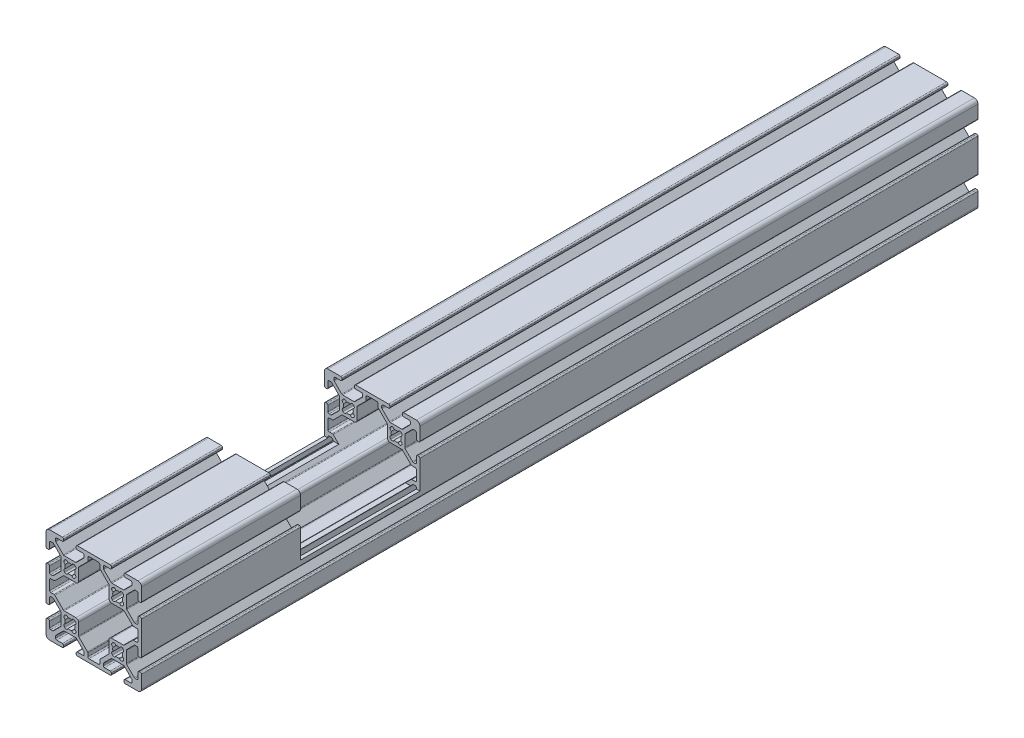
from build123d import *

# Parameters (mm, degrees)
EXTRUDE1_DEPTH     = 350
SKETCH2_W          = 50
SKETCH2_H          = 25
CUT_EXTRUDE2_DEPTH = 62


with BuildPart() as part:
    # Sketch1 → Extrude1 (new body)
    with BuildSketch(Plane.XY):
        with BuildLine():
            Line((-22.383919339, -3.655), (-17.616080661, -3.655))
            ThreePointArc((-17.616080661, -3.655), (-17.421677478, -3.693669197), (-17.256870417, -3.803789755))
            Line((-17.256870417, -3.803789755), (-14.153789755, -6.906870417))
            ThreePointArc((-14.153789755, -6.906870417), (-14.043669197, -7.071677478), (-14.005, -7.266080661))
            Line((-14.005, -7.266080661), (-14.005, -7.992))
            ThreePointArc((-14.005, -7.992), (-14.153789755, -8.351210245), (-14.513, -8.5))
            Line((-14.513, -8.5), (-16.862, -8.5))
            ThreePointArc((-16.862, -8.5), (-17.221210245, -8.648789755), (-17.37, -9.008))
            Line((-17.37, -9.008), (-17.37, -9.492))
            ThreePointArc((-17.37, -9.492), (-17.221210245, -9.851210245), (-16.862, -10))
            Line((-16.862, -10), (-3.138, -10))
            ThreePointArc((-3.138, -10), (-2.778789755, -9.851210245), (-2.63, -9.492))
            Line((-2.63, -9.492), (-2.63, -9.008))
            ThreePointArc((-2.63, -9.008), (-2.778789755, -8.648789755), (-3.138, -8.5))
            Line((-3.138, -8.5), (-5.487, -8.5))
            ThreePointArc((-5.487, -8.5), (-5.846210245, -8.351210245), (-5.995, -7.992))
            Line((-5.995, -7.992), (-5.995, -7.266080661))
            ThreePointArc((-5.995, -7.266080661), (-5.956330803, -7.071677478), (-5.846210245, -6.906870417))
            Line((-5.846210245, -6.906870417), (-2.743129583, -3.803789755))
            ThreePointArc((-2.743129583, -3.803789755), (-2.578322522, -3.693669197), (-2.383919339, -3.655))
            Line((-2.383919339, -3.655), (2.383919339, -3.655))
            ThreePointArc((2.383919339, -3.655), (2.578322522, -3.693669197), (2.743129583, -3.803789755))
            Line((2.743129583, -3.803789755), (5.846210245, -6.906870417))
            ThreePointArc((5.846210245, -6.906870417), (5.956330803, -7.071677478), (5.995, -7.266080661))
            Line((5.995, -7.266080661), (5.995, -7.992))
            ThreePointArc((5.995, -7.992), (5.846210245, -8.351210245), (5.487, -8.5))
            Line((5.487, -8.5), (3.138, -8.5))
            ThreePointArc((3.138, -8.5), (2.778789755, -8.648789755), (2.63, -9.008))
            Line((2.63, -9.008), (2.63, -9.492))
            ThreePointArc((2.63, -9.492), (2.778789755, -9.851210245), (3.138, -10))
            Line((3.138, -10), (8.5, -10))
            ThreePointArc((8.5, -10), (9.560660172, -9.560660172), (10, -8.5))
            Line((10, -8.5), (10, -3.138))
            ThreePointArc((10, -3.138), (9.851210245, -2.778789755), (9.492, -2.63))
            Line((9.492, -2.63), (9.008, -2.63))
            ThreePointArc((9.008, -2.63), (8.648789755, -2.778789755), (8.5, -3.138))
            Line((8.5, -3.138), (8.5, -5.487))
            ThreePointArc((8.5, -5.487), (8.351210245, -5.846210245), (7.992, -5.995))
            Line((7.992, -5.995), (7.266080661, -5.995))
            ThreePointArc((7.266080661, -5.995), (7.071677478, -5.956330803), (6.906870417, -5.846210245))
            Line((6.906870417, -5.846210245), (3.803789755, -2.743129583))
            ThreePointArc((3.803789755, -2.743129583), (3.693669197, -2.578322522), (3.655, -2.383919339))
            Line((3.655, -2.383919339), (3.655, 2.383919339))
            ThreePointArc((3.655, 2.383919339), (3.693669197, 2.578322522), (3.803789755, 2.743129583))
            Line((3.803789755, 2.743129583), (6.906870417, 5.846210245))
            ThreePointArc((6.906870417, 5.846210245), (7.071677478, 5.956330803), (7.266080661, 5.995))
            Line((7.266080661, 5.995), (7.992, 5.995))
            ThreePointArc((7.992, 5.995), (8.351210245, 5.846210245), (8.5, 5.487))
            Line((8.5, 5.487), (8.5, 3.138))
            ThreePointArc((8.5, 3.138), (8.648789755, 2.778789755), (9.008, 2.63))
            Line((9.008, 2.63), (9.492, 2.63))
            ThreePointArc((9.492, 2.63), (9.851210245, 2.778789755), (10, 3.138))
            Line((10, 3.138), (10, 16.862))
            ThreePointArc((10, 16.862), (9.851210245, 17.221210245), (9.492, 17.37))
            Line((9.492, 17.37), (9.008, 17.37))
            ThreePointArc((9.008, 17.37), (8.648789755, 17.221210245), (8.5, 16.862))
            Line((8.5, 16.862), (8.5, 14.513))
            ThreePointArc((8.5, 14.513), (8.351210245, 14.153789755), (7.992, 14.005))
            Line((7.992, 14.005), (7.266080661, 14.005))
            ThreePointArc((7.266080661, 14.005), (7.071677478, 14.043669197), (6.906870417, 14.153789755))
            Line((6.906870417, 14.153789755), (3.803789755, 17.256870417))
            ThreePointArc((3.803789755, 17.256870417), (3.693669197, 17.421677478), (3.655, 17.616080661))
            Line((3.655, 17.616080661), (3.655, 22.383919339))
            ThreePointArc((3.655, 22.383919339), (3.693669197, 22.578322522), (3.803789755, 22.743129583))
            Line((3.803789755, 22.743129583), (6.906870417, 25.846210245))
            ThreePointArc((6.906870417, 25.846210245), (7.071677478, 25.956330803), (7.266080661, 25.995))
            Line((7.266080661, 25.995), (7.992, 25.995))
            ThreePointArc((7.992, 25.995), (8.351210245, 25.846210245), (8.5, 25.487))
            Line((8.5, 25.487), (8.5, 23.138))
            ThreePointArc((8.5, 23.138), (8.648789755, 22.778789755), (9.008, 22.63))
            Line((9.008, 22.63), (9.492, 22.63))
            ThreePointArc((9.492, 22.63), (9.851210245, 22.778789755), (10, 23.138))
            Line((10, 23.138), (10, 28.5))
            ThreePointArc((10, 28.5), (9.560660172, 29.560660172), (8.5, 30))
            Line((8.5, 30), (3.138, 30))
            ThreePointArc((3.138, 30), (2.778789755, 29.851210245), (2.63, 29.492))
            Line((2.63, 29.492), (2.63, 29.008))
            ThreePointArc((2.63, 29.008), (2.778789755, 28.648789755), (3.138, 28.5))
            Line((3.138, 28.5), (5.487, 28.5))
            ThreePointArc((5.487, 28.5), (5.846210245, 28.351210245), (5.995, 27.992))
            Line((5.995, 27.992), (5.995, 27.266080661))
            ThreePointArc((5.995, 27.266080661), (5.956330803, 27.071677478), (5.846210245, 26.906870417))
            Line((5.846210245, 26.906870417), (2.743129583, 23.803789755))
            ThreePointArc((2.743129583, 23.803789755), (2.578322522, 23.693669197), (2.383919339, 23.655))
            Line((2.383919339, 23.655), (-2.383919339, 23.655))
            ThreePointArc((-2.383919339, 23.655), (-2.578322522, 23.693669197), (-2.743129583, 23.803789755))
            Line((-2.743129583, 23.803789755), (-5.846210245, 26.906870417))
            ThreePointArc((-5.846210245, 26.906870417), (-5.956330803, 27.071677478), (-5.995, 27.266080661))
            Line((-5.995, 27.266080661), (-5.995, 27.992))
            ThreePointArc((-5.995, 27.992), (-5.846210245, 28.351210245), (-5.487, 28.5))
            Line((-5.487, 28.5), (-3.138, 28.5))
            ThreePointArc((-3.138, 28.5), (-2.778789755, 28.648789755), (-2.63, 29.008))
            Line((-2.63, 29.008), (-2.63, 29.492))
            ThreePointArc((-2.63, 29.492), (-2.778789755, 29.851210245), (-3.138, 30))
            Line((-3.138, 30), (-16.862, 30))
            ThreePointArc((-16.862, 30), (-17.221210245, 29.851210245), (-17.37, 29.492))
            Line((-17.37, 29.492), (-17.37, 29.008))
            ThreePointArc((-17.37, 29.008), (-17.221210245, 28.648789755), (-16.862, 28.5))
            Line((-16.862, 28.5), (-14.513, 28.5))
            ThreePointArc((-14.513, 28.5), (-14.153789755, 28.351210245), (-14.005, 27.992))
            Line((-14.005, 27.992), (-14.005, 27.266080661))
            ThreePointArc((-14.005, 27.266080661), (-14.043669197, 27.071677478), (-14.153789755, 26.906870417))
            Line((-14.153789755, 26.906870417), (-17.256870417, 23.803789755))
            ThreePointArc((-17.256870417, 23.803789755), (-17.421677478, 23.693669197), (-17.616080661, 23.655))
            Line((-17.616080661, 23.655), (-22.383919339, 23.655))
            ThreePointArc((-22.383919339, 23.655), (-22.578322522, 23.693669197), (-22.743129583, 23.803789755))
            Line((-22.743129583, 23.803789755), (-25.846210245, 26.906870417))
            ThreePointArc((-25.846210245, 26.906870417), (-25.956330803, 27.071677478), (-25.995, 27.266080661))
            Line((-25.995, 27.266080661), (-25.995, 27.992))
            ThreePointArc((-25.995, 27.992), (-25.846210245, 28.351210245), (-25.487, 28.5))
            Line((-25.487, 28.5), (-23.138, 28.5))
            ThreePointArc((-23.138, 28.5), (-22.778789755, 28.648789755), (-22.63, 29.008))
            Line((-22.63, 29.008), (-22.63, 29.492))
            ThreePointArc((-22.63, 29.492), (-22.778789755, 29.851210245), (-23.138, 30))
            Line((-23.138, 30), (-28.5, 30))
            ThreePointArc((-28.5, 30), (-29.560660172, 29.560660172), (-30, 28.5))
            Line((-30, 28.5), (-30, 23.138))
            ThreePointArc((-30, 23.138), (-29.851210245, 22.778789755), (-29.492, 22.63))
            Line((-29.492, 22.63), (-29.008, 22.63))
            ThreePointArc((-29.008, 22.63), (-28.648789755, 22.778789755), (-28.5, 23.138))
            Line((-28.5, 23.138), (-28.5, 25.487))
            ThreePointArc((-28.5, 25.487), (-28.351210245, 25.846210245), (-27.992, 25.995))
            Line((-27.992, 25.995), (-27.266080661, 25.995))
            ThreePointArc((-27.266080661, 25.995), (-27.071677478, 25.956330803), (-26.906870417, 25.846210245))
            Line((-26.906870417, 25.846210245), (-23.803789755, 22.743129583))
            ThreePointArc((-23.803789755, 22.743129583), (-23.693669197, 22.578322522), (-23.655, 22.383919339))
            Line((-23.655, 22.383919339), (-23.655, 17.616080661))
            ThreePointArc((-23.655, 17.616080661), (-23.693669197, 17.421677478), (-23.803789755, 17.256870417))
            Line((-23.803789755, 17.256870417), (-26.906870417, 14.153789755))
            ThreePointArc((-26.906870417, 14.153789755), (-27.071677478, 14.043669197), (-27.266080661, 14.005))
            Line((-27.266080661, 14.005), (-27.992, 14.005))
            ThreePointArc((-27.992, 14.005), (-28.351210245, 14.153789755), (-28.5, 14.513))
            Line((-28.5, 14.513), (-28.5, 16.862))
            ThreePointArc((-28.5, 16.862), (-28.648789755, 17.221210245), (-29.008, 17.37))
            Line((-29.008, 17.37), (-29.492, 17.37))
            ThreePointArc((-29.492, 17.37), (-29.851210245, 17.221210245), (-30, 16.862))
            Line((-30, 16.862), (-30, 3.138))
            ThreePointArc((-30, 3.138), (-29.851210245, 2.778789755), (-29.492, 2.63))
            Line((-29.492, 2.63), (-29.008, 2.63))
            ThreePointArc((-29.008, 2.63), (-28.648789755, 2.778789755), (-28.5, 3.138))
            Line((-28.5, 3.138), (-28.5, 5.487))
            ThreePointArc((-28.5, 5.487), (-28.351210245, 5.846210245), (-27.992, 5.995))
            Line((-27.992, 5.995), (-27.266080661, 5.995))
            ThreePointArc((-27.266080661, 5.995), (-27.071677478, 5.956330803), (-26.906870417, 5.846210245))
            Line((-26.906870417, 5.846210245), (-23.803789755, 2.743129583))
            ThreePointArc((-23.803789755, 2.743129583), (-23.693669197, 2.578322522), (-23.655, 2.383919339))
            Line((-23.655, 2.383919339), (-23.655, -2.383919339))
            ThreePointArc((-23.655, -2.383919339), (-23.693669197, -2.578322522), (-23.803789755, -2.743129583))
            Line((-23.803789755, -2.743129583), (-26.906870417, -5.846210245))
            ThreePointArc((-26.906870417, -5.846210245), (-27.071677478, -5.956330803), (-27.266080661, -5.995))
            Line((-27.266080661, -5.995), (-27.992, -5.995))
            ThreePointArc((-27.992, -5.995), (-28.351210245, -5.846210245), (-28.5, -5.487))
            Line((-28.5, -5.487), (-28.5, -3.138))
            ThreePointArc((-28.5, -3.138), (-28.648789755, -2.778789755), (-29.008, -2.63))
            Line((-29.008, -2.63), (-29.492, -2.63))
            ThreePointArc((-29.492, -2.63), (-29.851210245, -2.778789755), (-30, -3.138))
            Line((-30, -3.138), (-30, -8.5))
            ThreePointArc((-30, -8.5), (-29.560660172, -9.560660172), (-28.5, -10))
            Line((-28.5, -10), (-23.138, -10))
            ThreePointArc((-23.138, -10), (-22.778789755, -9.851210245), (-22.63, -9.492))
            Line((-22.63, -9.492), (-22.63, -9.008))
            ThreePointArc((-22.63, -9.008), (-22.778789755, -8.648789755), (-23.138, -8.5))
            Line((-23.138, -8.5), (-25.487, -8.5))
            ThreePointArc((-25.487, -8.5), (-25.846210245, -8.351210245), (-25.995, -7.992))
            Line((-25.995, -7.992), (-25.995, -7.266080661))
            ThreePointArc((-25.995, -7.266080661), (-25.956330803, -7.071677478), (-25.846210245, -6.906870417))
            Line((-25.846210245, -6.906870417), (-22.743129583, -3.803789755))
            ThreePointArc((-22.743129583, -3.803789755), (-22.578322522, -3.693669197), (-22.383919339, -3.655))
        make_face()
        with BuildLine():
            Line((-2.124900844, 17.695494034), (-2.304505966, 17.875099156))
            ThreePointArc((-2.304505966, 17.875099156), (-2.505938017, 18.643532189), (-1.935133506, 19.196023282))
            ThreePointArc((-1.935133506, 19.196023282), (-2.0955, 20), (-1.935133506, 20.803976718))
            ThreePointArc((-1.935133506, 20.803976718), (-2.505938017, 21.356467811), (-2.304505966, 22.124900844))
            Line((-2.304505966, 22.124900844), (-2.124900844, 22.304505966))
            ThreePointArc((-2.124900844, 22.304505966), (-1.356467811, 22.505938017), (-0.803976718, 21.935133506))
            ThreePointArc((-0.803976718, 21.935133506), (0, 22.0955), (0.803976718, 21.935133506))
            ThreePointArc((0.803976718, 21.935133506), (1.356467811, 22.505938017), (2.124900844, 22.304505966))
            Line((2.124900844, 22.304505966), (2.304505966, 22.124900844))
            ThreePointArc((2.304505966, 22.124900844), (2.505938017, 21.356467811), (1.935133506, 20.803976718))
            ThreePointArc((1.935133506, 20.803976718), (2.0955, 20), (1.935133506, 19.196023282))
            ThreePointArc((1.935133506, 19.196023282), (2.505938017, 18.643532189), (2.304505966, 17.875099156))
            Line((2.304505966, 17.875099156), (2.124900844, 17.695494034))
            ThreePointArc((2.124900844, 17.695494034), (1.356467811, 17.494061983), (0.803976718, 18.064866494))
            ThreePointArc((0.803976718, 18.064866494), (0, 17.9045), (-0.803976718, 18.064866494))
            ThreePointArc((-0.803976718, 18.064866494), (-1.356467811, 17.494061983), (-2.124900844, 17.695494034))
        make_face(mode=Mode.SUBTRACT)
        with BuildLine():
            Line((-22.124900844, 17.695494034), (-22.304505966, 17.875099156))
            ThreePointArc((-22.304505966, 17.875099156), (-22.505938017, 18.643532189), (-21.935133506, 19.196023282))
            ThreePointArc((-21.935133506, 19.196023282), (-22.0955, 20), (-21.935133506, 20.803976718))
            ThreePointArc((-21.935133506, 20.803976718), (-22.505938017, 21.356467811), (-22.304505966, 22.124900844))
            Line((-22.304505966, 22.124900844), (-22.124900844, 22.304505966))
            ThreePointArc((-22.124900844, 22.304505966), (-21.356467811, 22.505938017), (-20.803976718, 21.935133506))
            ThreePointArc((-20.803976718, 21.935133506), (-20, 22.0955), (-19.196023282, 21.935133506))
            ThreePointArc((-19.196023282, 21.935133506), (-18.643532189, 22.505938017), (-17.875099156, 22.304505966))
            Line((-17.875099156, 22.304505966), (-17.695494034, 22.124900844))
            ThreePointArc((-17.695494034, 22.124900844), (-17.494061983, 21.356467811), (-18.064866494, 20.803976718))
            ThreePointArc((-18.064866494, 20.803976718), (-17.9045, 20), (-18.064866494, 19.196023282))
            ThreePointArc((-18.064866494, 19.196023282), (-17.494061983, 18.643532189), (-17.695494034, 17.875099156))
            Line((-17.695494034, 17.875099156), (-17.875099156, 17.695494034))
            ThreePointArc((-17.875099156, 17.695494034), (-18.643532189, 17.494061983), (-19.196023282, 18.064866494))
            ThreePointArc((-19.196023282, 18.064866494), (-20, 17.9045), (-20.803976718, 18.064866494))
            ThreePointArc((-20.803976718, 18.064866494), (-21.356467811, 17.494061983), (-22.124900844, 17.695494034))
        make_face(mode=Mode.SUBTRACT)
        with BuildLine():
            Line((-2.124900844, -2.304505966), (-2.304505966, -2.124900844))
            ThreePointArc((-2.304505966, -2.124900844), (-2.505938017, -1.356467811), (-1.935133506, -0.803976718))
            ThreePointArc((-1.935133506, -0.803976718), (-2.0955, 0), (-1.935133506, 0.803976718))
            ThreePointArc((-1.935133506, 0.803976718), (-2.505938017, 1.356467811), (-2.304505966, 2.124900844))
            Line((-2.304505966, 2.124900844), (-2.124900844, 2.304505966))
            ThreePointArc((-2.124900844, 2.304505966), (-1.356467811, 2.505938017), (-0.803976718, 1.935133506))
            ThreePointArc((-0.803976718, 1.935133506), (0, 2.0955), (0.803976718, 1.935133506))
            ThreePointArc((0.803976718, 1.935133506), (1.356467811, 2.505938017), (2.124900844, 2.304505966))
            Line((2.124900844, 2.304505966), (2.304505966, 2.124900844))
            ThreePointArc((2.304505966, 2.124900844), (2.505938017, 1.356467811), (1.935133506, 0.803976718))
            ThreePointArc((1.935133506, 0.803976718), (2.0955, 0), (1.935133506, -0.803976718))
            ThreePointArc((1.935133506, -0.803976718), (2.505938017, -1.356467811), (2.304505966, -2.124900844))
            Line((2.304505966, -2.124900844), (2.124900844, -2.304505966))
            ThreePointArc((2.124900844, -2.304505966), (1.356467811, -2.505938017), (0.803976718, -1.935133506))
            ThreePointArc((0.803976718, -1.935133506), (0, -2.0955), (-0.803976718, -1.935133506))
            ThreePointArc((-0.803976718, -1.935133506), (-1.356467811, -2.505938017), (-2.124900844, -2.304505966))
        make_face(mode=Mode.SUBTRACT)
        with BuildLine():
            Line((-12.505, -7.992), (-12.505, -6.644760318))
            ThreePointArc((-12.505, -6.644760318), (-12.543669197, -6.450357134), (-12.653789755, -6.285550073))
            Line((-12.653789755, -6.285550073), (-16.196210245, -2.743129583))
            ThreePointArc((-16.196210245, -2.743129583), (-16.306330803, -2.578322522), (-16.345, -2.383919339))
            Line((-16.345, -2.383919339), (-16.345, 2.512))
            ThreePointArc((-16.345, 2.512), (-16.679776949, 3.320223051), (-17.488, 3.655))
            Line((-17.488, 3.655), (-22.383919339, 3.655))
            ThreePointArc((-22.383919339, 3.655), (-22.578322522, 3.693669197), (-22.743129583, 3.803789755))
            Line((-22.743129583, 3.803789755), (-26.285550073, 7.346210245))
            ThreePointArc((-26.285550073, 7.346210245), (-26.450357134, 7.456330803), (-26.644760318, 7.495))
            Line((-26.644760318, 7.495), (-27.992, 7.495))
            ThreePointArc((-27.992, 7.495), (-28.351210245, 7.643789755), (-28.5, 8.003))
            Line((-28.5, 8.003), (-28.5, 11.997))
            ThreePointArc((-28.5, 11.997), (-28.351210245, 12.356210245), (-27.992, 12.505))
            Line((-27.992, 12.505), (-26.644760318, 12.505))
            ThreePointArc((-26.644760318, 12.505), (-26.450357134, 12.543669197), (-26.285550073, 12.653789755))
            Line((-26.285550073, 12.653789755), (-22.743129583, 16.196210245))
            ThreePointArc((-22.743129583, 16.196210245), (-22.578322522, 16.306330803), (-22.383919339, 16.345))
            Line((-22.383919339, 16.345), (-17.488, 16.345))
            ThreePointArc((-17.488, 16.345), (-16.679776949, 16.679776949), (-16.345, 17.488))
            Line((-16.345, 17.488), (-16.345, 22.383919339))
            ThreePointArc((-16.345, 22.383919339), (-16.306330803, 22.578322522), (-16.196210245, 22.743129583))
            Line((-16.196210245, 22.743129583), (-12.653789755, 26.285550073))
            ThreePointArc((-12.653789755, 26.285550073), (-12.543669197, 26.450357134), (-12.505, 26.644760318))
            Line((-12.505, 26.644760318), (-12.505, 27.992))
            ThreePointArc((-12.505, 27.992), (-12.356210245, 28.351210245), (-11.997, 28.5))
            Line((-11.997, 28.5), (-8.003, 28.5))
            ThreePointArc((-8.003, 28.5), (-7.643789755, 28.351210245), (-7.495, 27.992))
            Line((-7.495, 27.992), (-7.495, 26.644760318))
            ThreePointArc((-7.495, 26.644760318), (-7.456330803, 26.450357134), (-7.346210245, 26.285550073))
            Line((-7.346210245, 26.285550073), (-3.803789755, 22.743129583))
            ThreePointArc((-3.803789755, 22.743129583), (-3.693669197, 22.578322522), (-3.655, 22.383919339))
            Line((-3.655, 22.383919339), (-3.655, 17.488))
            ThreePointArc((-3.655, 17.488), (-3.320223051, 16.679776949), (-2.512, 16.345))
            Line((-2.512, 16.345), (2.383919339, 16.345))
            ThreePointArc((2.383919339, 16.345), (2.578322522, 16.306330803), (2.743129583, 16.196210245))
            Line((2.743129583, 16.196210245), (6.285550073, 12.653789755))
            ThreePointArc((6.285550073, 12.653789755), (6.450357134, 12.543669197), (6.644760318, 12.505))
            Line((6.644760318, 12.505), (7.992, 12.505))
            ThreePointArc((7.992, 12.505), (8.351210245, 12.356210245), (8.5, 11.997))
            Line((8.5, 11.997), (8.5, 8.003))
            ThreePointArc((8.5, 8.003), (8.351210245, 7.643789755), (7.992, 7.495))
            Line((7.992, 7.495), (6.644760318, 7.495))
            ThreePointArc((6.644760318, 7.495), (6.450357134, 7.456330803), (6.285550073, 7.346210245))
            Line((6.285550073, 7.346210245), (2.743129583, 3.803789755))
            ThreePointArc((2.743129583, 3.803789755), (2.578322522, 3.693669197), (2.383919339, 3.655))
            Line((2.383919339, 3.655), (-2.512, 3.655))
            ThreePointArc((-2.512, 3.655), (-3.320223051, 3.320223051), (-3.655, 2.512))
            Line((-3.655, 2.512), (-3.655, -2.383919339))
            ThreePointArc((-3.655, -2.383919339), (-3.693669197, -2.578322522), (-3.803789755, -2.743129583))
            Line((-3.803789755, -2.743129583), (-7.346210245, -6.285550073))
            ThreePointArc((-7.346210245, -6.285550073), (-7.456330803, -6.450357134), (-7.495, -6.644760318))
            Line((-7.495, -6.644760318), (-7.495, -7.992))
            ThreePointArc((-7.495, -7.992), (-7.643789755, -8.351210245), (-8.003, -8.5))
            Line((-8.003, -8.5), (-11.997, -8.5))
            ThreePointArc((-11.997, -8.5), (-12.356210245, -8.351210245), (-12.505, -7.992))
        make_face(mode=Mode.SUBTRACT)
        with BuildLine():
            Line((-22.124900844, -2.304505966), (-22.304505966, -2.124900844))
            ThreePointArc((-22.304505966, -2.124900844), (-22.505938017, -1.356467811), (-21.935133506, -0.803976718))
            ThreePointArc((-21.935133506, -0.803976718), (-22.0955, 0), (-21.935133506, 0.803976718))
            ThreePointArc((-21.935133506, 0.803976718), (-22.505938017, 1.356467811), (-22.304505966, 2.124900844))
            Line((-22.304505966, 2.124900844), (-22.124900844, 2.304505966))
            ThreePointArc((-22.124900844, 2.304505966), (-21.356467811, 2.505938017), (-20.803976718, 1.935133506))
            ThreePointArc((-20.803976718, 1.935133506), (-20, 2.0955), (-19.196023282, 1.935133506))
            ThreePointArc((-19.196023282, 1.935133506), (-18.643532189, 2.505938017), (-17.875099156, 2.304505966))
            Line((-17.875099156, 2.304505966), (-17.695494034, 2.124900844))
            ThreePointArc((-17.695494034, 2.124900844), (-17.494061983, 1.356467811), (-18.064866494, 0.803976718))
            ThreePointArc((-18.064866494, 0.803976718), (-17.9045, 0), (-18.064866494, -0.803976718))
            ThreePointArc((-18.064866494, -0.803976718), (-17.494061983, -1.356467811), (-17.695494034, -2.124900844))
            Line((-17.695494034, -2.124900844), (-17.875099156, -2.304505966))
            ThreePointArc((-17.875099156, -2.304505966), (-18.643532189, -2.505938017), (-19.196023282, -1.935133506))
            ThreePointArc((-19.196023282, -1.935133506), (-20, -2.0955), (-20.803976718, -1.935133506))
            ThreePointArc((-20.803976718, -1.935133506), (-21.356467811, -2.505938017), (-22.124900844, -2.304505966))
        make_face(mode=Mode.SUBTRACT)
    extrude(amount=-EXTRUDE1_DEPTH)

    # Sketch2 → Cut-Extrude2 (cut)
    with BuildSketch(Plane(origin=(10, 0, 0), x_dir=(0, 0, -1), z_dir=(1, 0, 0))):
        with Locations((91.486543565, 17.5)):
            Rectangle(SKETCH2_W, SKETCH2_H)
    extrude(amount=-CUT_EXTRUDE2_DEPTH, mode=Mode.SUBTRACT)


solid = part.part
